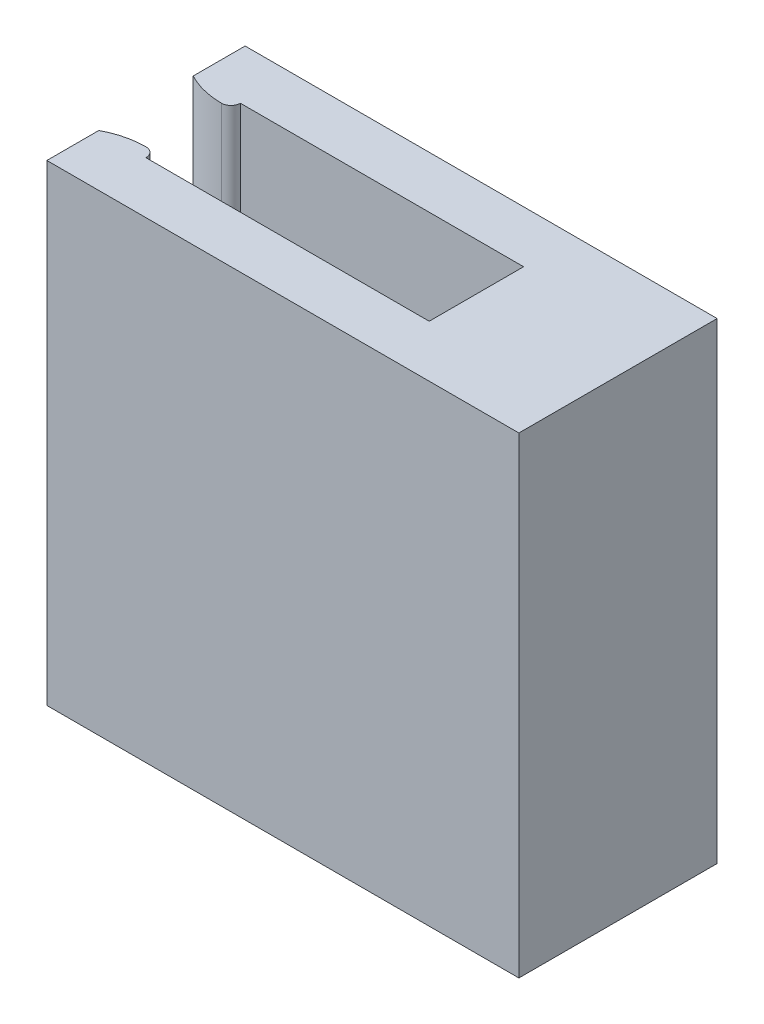
from build123d import *

# Parameters (mm, degrees)
SKETCH1_W               = 30
SKETCH1_H               = 75
MAIN_BLOCK_DEPTH        = 25
FRAME_HOLE_REACH        = 82.467
SKETCH2_R               = 5
EM_ROD_HOLES_REACH      = 56.141
EM_ROD_HOLES_SKETCH_R   = 5
BOSS_EXTRUDE1_DEPTH     = 10
CUT_EXTRUDE1_DEPTH      = 52.53882032
CUT_EXTRUDE1_DEPTH_BACK = 52.53882032
SKETCH5_W               = 30
SKETCH5_H               = 75


with BuildPart() as part:
    # Sketch1 → Main Block (new, symmetric)
    with BuildSketch(Plane(origin=(0, 0, 0), x_dir=(1, 0, 0), z_dir=(0, 1, 0))):
        Rectangle(SKETCH1_W, SKETCH1_H)
    extrude(amount=MAIN_BLOCK_DEPTH, both=True)

    # Sketch2 → Frame Hole (cut, up to next)
    with BuildSketch(Plane.XY.offset(37.5), mode=Mode.PRIVATE) as frame_hole_sk1:
        with Locations((0, -15)):
            Circle(SKETCH2_R)
    frame_hole_tool1 = extrude(frame_hole_sk1.sketch, amount=-FRAME_HOLE_REACH, mode=Mode.PRIVATE) & part.part
    add(frame_hole_tool1.solids().sort_by_distance((0, -15, 37.5))[0], mode=Mode.SUBTRACT)

    # EM Rod Holes Sketch → EM Rod Holes (cut, up to next)
    with BuildSketch(Plane(origin=(15, 0, 0), x_dir=(0, 0, -1), z_dir=(1, 0, 0)), mode=Mode.PRIVATE) as em_rod_holes_sk1:
        with Locations((-15, 15)):
            Circle(EM_ROD_HOLES_SKETCH_R)
    em_rod_holes_tool1 = extrude(em_rod_holes_sk1.sketch, amount=-EM_ROD_HOLES_REACH, mode=Mode.PRIVATE) & part.part
    # EM Rod Holes Sketch → EM Rod Holes (cut, up to next)
    with BuildSketch(Plane(origin=(15, 0, 0), x_dir=(0, 0, -1), z_dir=(1, 0, 0)), mode=Mode.PRIVATE) as em_rod_holes_sk2:
        with Locations((15, 15)):
            Circle(EM_ROD_HOLES_SKETCH_R)
    em_rod_holes_tool2 = extrude(em_rod_holes_sk2.sketch, amount=-EM_ROD_HOLES_REACH, mode=Mode.PRIVATE) & part.part
    add(em_rod_holes_tool1.solids().sort_by_distance((15, 15, 15))[0], mode=Mode.SUBTRACT)
    add(em_rod_holes_tool2.solids().sort_by_distance((15, 15, -15))[0], mode=Mode.SUBTRACT)

    # Sketch4 → Boss-Extrude1 (add)
    with BuildSketch(Plane.XZ.offset(25)):
        Polygon((-15, 33.3), (-15, 37.5), (-25, 37.5), (-25, 36.4), (-24, 36.4), (-18, 36.4), (-18, 34.4), (-24, 34.4), (-25, 34.4), (-25, 33.3), align=None)
        with BuildLine():
            Line((-24, 36.4), (-25, 36.4))
            ThreePointArc((-25, 36.4), (-24.612310563, 36.25075775), (-24.2, 36.2))
            ThreePointArc((-24.2, 36.2), (-24.058578644, 36.258578644), (-24, 36.4))
        make_face()
        with BuildLine():
            ThreePointArc((-24.2, 34.6), (-24.612310563, 34.54924225), (-25, 34.4))
            Line((-25, 34.4), (-24, 34.4))
            ThreePointArc((-24, 34.4), (-24.058578644, 34.541421356), (-24.2, 34.6))
        make_face()
    extrude(amount=-BOSS_EXTRUDE1_DEPTH)

    # Sketch5 → Cut-Extrude1 (cut, two sides: drawn at the far end of the back side and taken through both)
    with BuildSketch(Plane(origin=(0, 0, 0), x_dir=(1, 0, 0), z_dir=(0, 1, 0)).offset(-CUT_EXTRUDE1_DEPTH_BACK)):
        Rectangle(SKETCH5_W, SKETCH5_H)
    extrude(amount=CUT_EXTRUDE1_DEPTH + CUT_EXTRUDE1_DEPTH_BACK, mode=Mode.SUBTRACT)


solid = part.part
